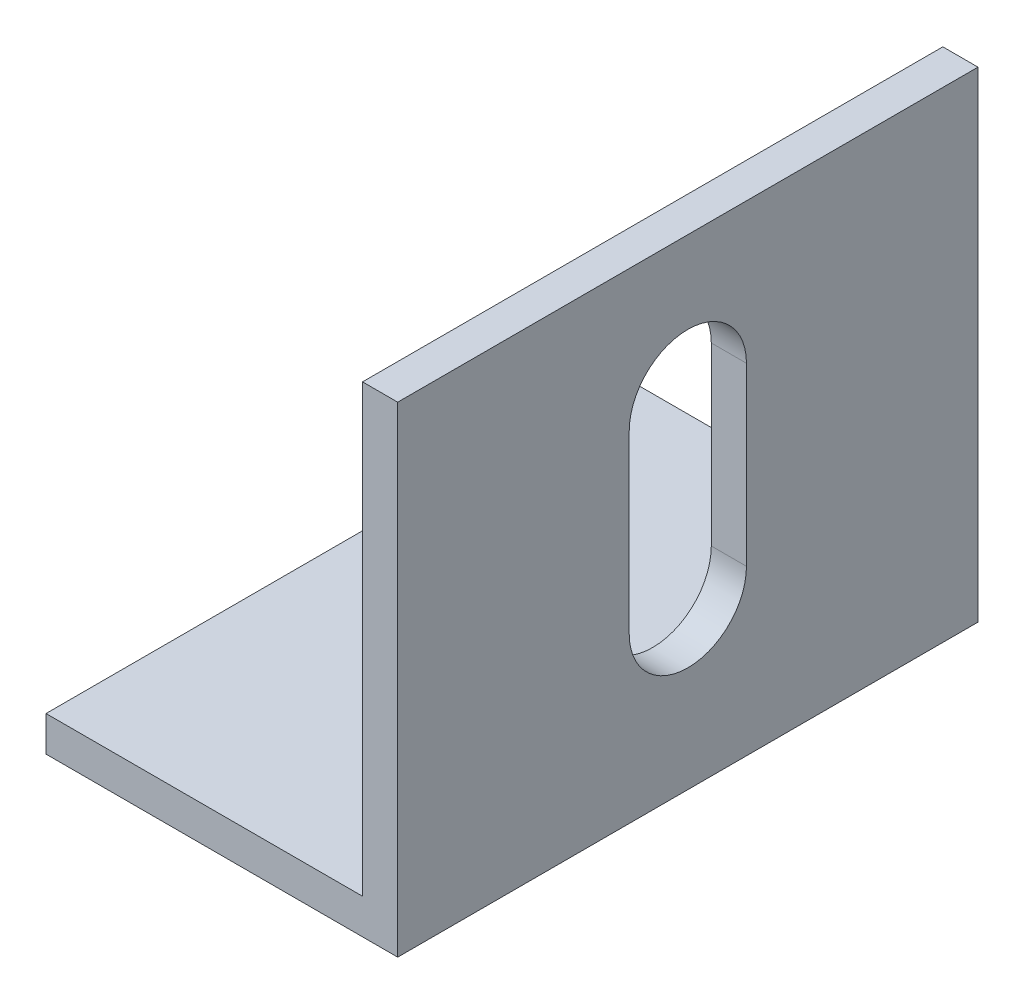
from build123d import *

# Parameters (mm, degrees)
BOSS_EXTRUDE2_DEPTH = 25.146
CUT_EXTRUDE1_REACH  = 37.415
CUT_EXTRUDE2_REACH  = 37.174
SKETCH4_R           = 2.54


with BuildPart() as part:
    # Sketch1 → Boss-Extrude2 (new body)
    with BuildSketch(Plane.XY):
        Polygon((-15.24, 0), (0, 0), (0, 20.828), (-1.524, 20.828), (-1.524, 1.524), (-15.24, 1.524), align=None)
    extrude(amount=BOSS_EXTRUDE2_DEPTH)

    # Sketch3 → Cut-Extrude1 (cut, up to next)
    with BuildSketch(Plane.ZY.offset(1.524), mode=Mode.PRIVATE) as cut_extrude1_sk1:
        with BuildLine():
            Line((15.113, 14.732), (15.113, 7.112))
            ThreePointArc((15.113, 7.112), (12.573, 4.572), (10.033, 7.112))
            Line((10.033, 7.112), (10.033, 14.732))
            ThreePointArc((10.033, 14.732), (12.573, 17.272), (15.113, 14.732))
        make_face()
    cut_extrude1_tool1 = extrude(cut_extrude1_sk1.sketch, amount=-CUT_EXTRUDE1_REACH, mode=Mode.PRIVATE) & part.part
    add(cut_extrude1_tool1.solids().sort_by_distance((-1.524, 10.922, 12.573))[0], mode=Mode.SUBTRACT)

    # Sketch4 → Cut-Extrude2 (cut, up to next)
    with BuildSketch(Plane(origin=(0, 1.524, 0), x_dir=(1, 0, 0), z_dir=(0, 1, 0)), mode=Mode.PRIVATE) as cut_extrude2_sk1:
        with Locations(Location((-6.731, -12.573, 0), (0, 0, 180))):
            Circle(SKETCH4_R)
    cut_extrude2_tool1 = extrude(cut_extrude2_sk1.sketch, amount=-CUT_EXTRUDE2_REACH, mode=Mode.PRIVATE) & part.part
    add(cut_extrude2_tool1.solids().sort_by_distance((-6.731, 1.524, 12.573))[0], mode=Mode.SUBTRACT)


solid = part.part
